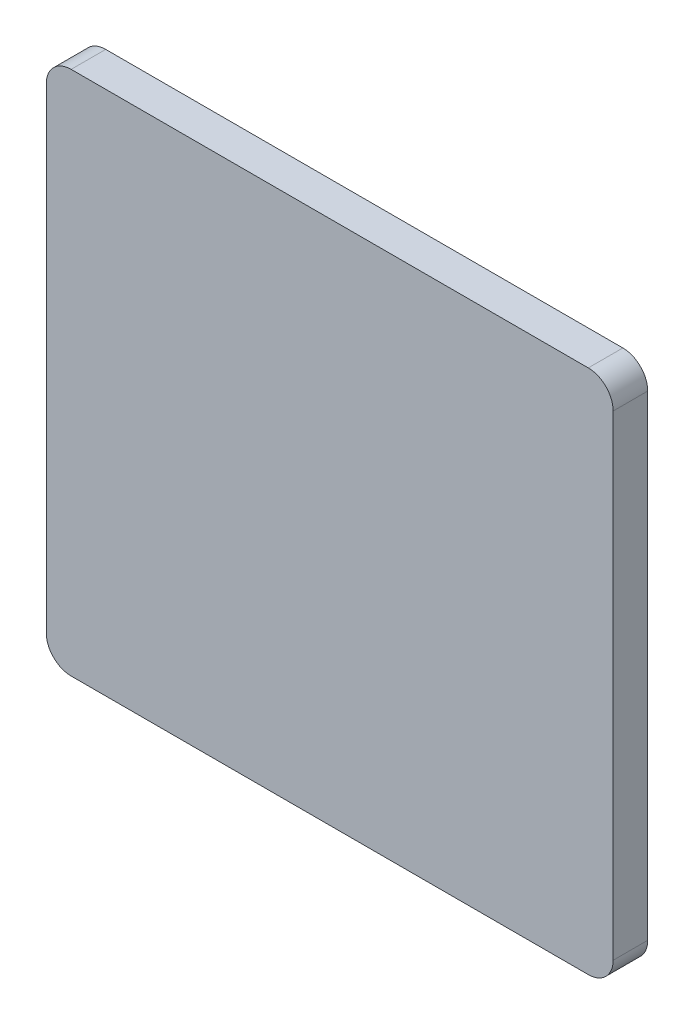
from build123d import *

# Parameters (mm, degrees)
FACTORY_SNAP_LID_DEPTH             = 2.5
MOULDED_LID_UNDERSIDE_RELIEF_DEPTH = 0.7


with BuildPart() as part:
    # Factory_snap_lid_Sketch → Factory_snap_lid (new body)
    with BuildSketch(Plane.XY):
        with BuildLine():
            Line((-18.7, -19), (18.7, -19))
            ThreePointArc((18.7, -19), (19.972792206, -18.472792206), (20.5, -17.2))
            Line((20.5, -17.2), (20.5, 17.2))
            ThreePointArc((20.5, 17.2), (19.972792206, 18.472792206), (18.7, 19))
            Line((18.7, 19), (-18.7, 19))
            ThreePointArc((-18.7, 19), (-19.972792206, 18.472792206), (-20.5, 17.2))
            Line((-20.5, 17.2), (-20.5, -17.2))
            ThreePointArc((-20.5, -17.2), (-19.972792206, -18.472792206), (-18.7, -19))
        make_face()
    extrude(amount=FACTORY_SNAP_LID_DEPTH)

    # Moulded_lid_underside_relief_Sketch → Moulded_lid_underside_relief (cut)
    with BuildSketch(Plane.XY):
        with BuildLine():
            Line((-17.4, -16.9), (17.4, -16.9))
            ThreePointArc((17.4, -16.9), (18.107106781, -16.607106781), (18.4, -15.9))
            Line((18.4, -15.9), (18.4, 15.9))
            ThreePointArc((18.4, 15.9), (18.107106781, 16.607106781), (17.4, 16.9))
            Line((17.4, 16.9), (-17.4, 16.9))
            ThreePointArc((-17.4, 16.9), (-18.107106781, 16.607106781), (-18.4, 15.9))
            Line((-18.4, 15.9), (-18.4, -15.9))
            ThreePointArc((-18.4, -15.9), (-18.107106781, -16.607106781), (-17.4, -16.9))
        make_face()
    extrude(amount=MOULDED_LID_UNDERSIDE_RELIEF_DEPTH, mode=Mode.SUBTRACT)


solid = part.part
